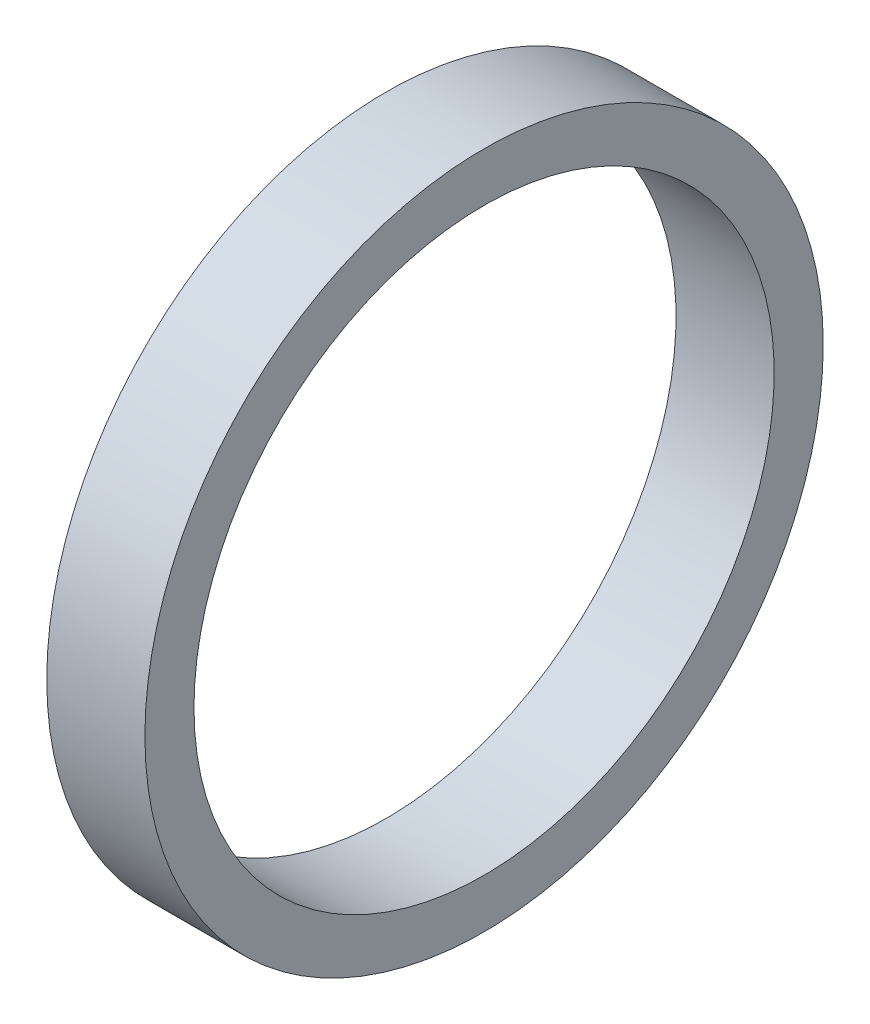
from build123d import *

# Parameters (mm, degrees)
ESQUISSE1_W = 8
ESQUISSE1_H = 4


with BuildPart() as part:
    # Esquisse1 → Révolution1 (revolve)
    with BuildSketch(Plane.XY, mode=Mode.PRIVATE) as r_volution1_sk:
        with Locations((-23.050614754, 25.65)):
            Rectangle(ESQUISSE1_W, ESQUISSE1_H)
    revolve(r_volution1_sk.sketch.rotate(Axis((-74.144057377, 0, 0), (1, 0, 0)), 90), axis=Axis((-74.144057377, 0, 0), (1, 0, 0)))


solid = part.part
